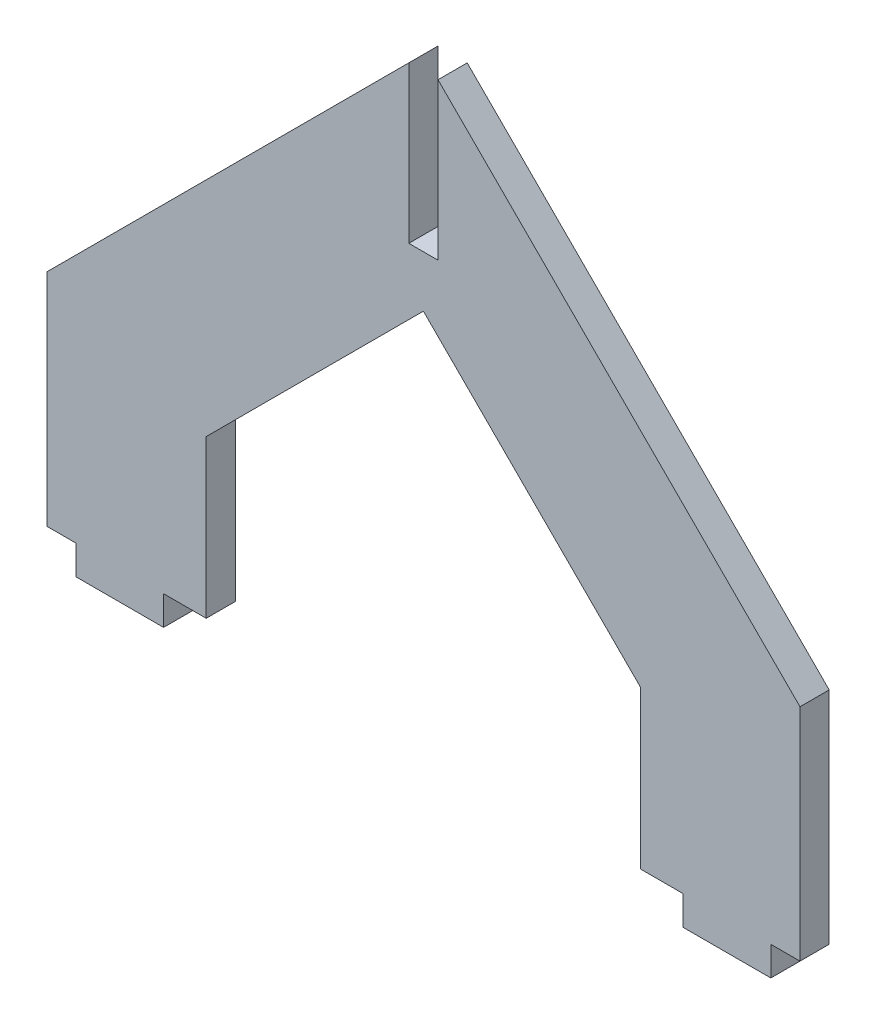
from build123d import *

# Parameters (mm, degrees)
BOSS_EXTRUDE1_DEPTH = 5
CUT_EXTRUDE1_DEPTH  = 10
SKETCH3_W           = 102.016100564
SKETCH3_H           = 114.3636127
CUT_EXTRUDE2_DEPTH  = 10
SKETCH4_W           = 42.096187012
SKETCH4_H           = 80.761359859
CUT_EXTRUDE3_DEPTH  = 10
SKETCH5_W           = 5
SKETCH5_H           = 58.521368684
CUT_EXTRUDE4_DEPTH  = 10


with BuildPart() as part:
    # Sketch1 → Boss-Extrude1 (new body)
    with BuildSketch(Plane.XY):
        Polygon((34.65186026, 42.723894515), (99.138982873, 107.211017127), (200, 6.35), (185, 6.35), (185, 0), (170, 0), (170, 6.35), (165, 6.35), (100.675, 70.675), (61.950419081, 31.950419081), (61.950419081, 5), (54.65186026, 5), (54.65186026, 0), (39.65186026, 0), (39.65186026, 5), (34.65186026, 5), align=None)
    boss_extrude1 = extrude(amount=BOSS_EXTRUDE1_DEPTH)

    # Sketch2 → Cut-Extrude1 (cut)
    with BuildSketch(Plane.XY.offset(5)):
        Polygon((96.638982873, 104.711017127), (96.638982873, 80.711017127), (101.638982873, 80.711017127), (101.638982873, 104.711017127), (99.138982873, 107.211017127), align=None)
    extrude(amount=-CUT_EXTRUDE1_DEPTH, mode=Mode.SUBTRACT)

    # Sketch3 → Cut-Extrude2 (cut)
    with BuildSketch(Plane.XY.offset(5)):
        with Locations((150.147033155, 51.840357155)):
            Rectangle(SKETCH3_W, SKETCH3_H)
    extrude(amount=-CUT_EXTRUDE2_DEPTH, mode=Mode.SUBTRACT)

    # Mirror1: Boss-Extrude1 across plane
    add(boss_extrude1.mirror(Plane(origin=(99.138982873, 109.022163505, -5), x_dir=(0, 0, 1), z_dir=(-1, 0, 0))))

    # Sketch4 → Cut-Extrude3 (cut)
    with BuildSketch(Plane(origin=(0, 0, 0), x_dir=(-1, 0, 0), z_dir=(0, 0, -1))):
        with Locations((-13.603766754, 32.73650171)):
            Rectangle(SKETCH4_W, SKETCH4_H)
    extrude(amount=-CUT_EXTRUDE3_DEPTH, mode=Mode.SUBTRACT)

    # Sketch5 → Cut-Extrude4 (cut)
    with BuildSketch(Plane(origin=(0, 0, 0), x_dir=(-1, 0, 0), z_dir=(0, 0, -1))):
        with Locations((-99.138982873, 107.211017127)):
            Rectangle(SKETCH5_W, SKETCH5_H)
    extrude(amount=-CUT_EXTRUDE4_DEPTH, mode=Mode.SUBTRACT)


solid = part.part
